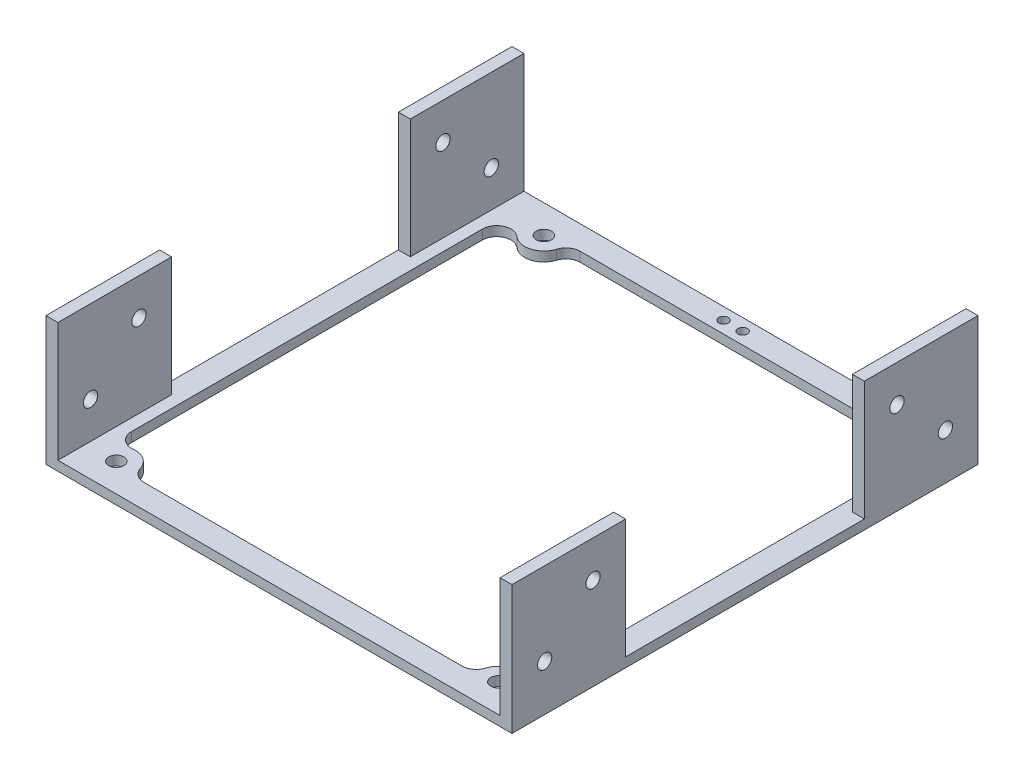
from build123d import *

# Parameters (mm, degrees)
SKETCH_1_W          = 97.6
SKETCH_1_H          = 97.6
SKETCH_1_R          = 1.59
EXTRUDE_1_DEPTH     = 2
SKETCH_2_R          = 1
CUT_EXTRUDE_1_DEPTH = 139.04173282
SKETCH_7_W          = 2.5
SKETCH_7_H          = 23.8
EXTRUDE_2_DEPTH     = 25
SKETCH_8_R          = 1.5
CUT_EXTRUDE_2_DEPTH = 141.643236595


with BuildPart() as part:
    # Эскиз1 → Бобышка-Вытянуть1 (new body)
    with BuildSketch(Plane(origin=(0, 0, 0), x_dir=(1, 0, 0), z_dir=(0, 1, 0))):
        with Locations((48.8, 48.8)):
            Rectangle(SKETCH_1_W, SKETCH_1_H)
        with Locations(Location((86.265001451, 91.665000306, 0), (0, 0, 270))):
            Circle(SKETCH_1_R, mode=Mode.SUBTRACT)
        with Locations(Location((88.805001451, 5.935000306, 0), (0, 0, 270))):
            Circle(SKETCH_1_R, mode=Mode.SUBTRACT)
        with Locations(Location((8.795001451, 5.935000306, 0), (0, 0, 270))):
            Circle(SKETCH_1_R, mode=Mode.SUBTRACT)
        with Locations(Location((12.605001451, 91.665000306, 0), (0, 0, 270))):
            Circle(SKETCH_1_R, mode=Mode.SUBTRACT)
        with BuildLine():
            Line((79.576520776, 92.6), (19.293482126, 92.6))
            ThreePointArc((19.293482126, 92.6), (17.512330868, 92.014021582), (16.426990408, 90.485000131))
            ThreePointArc((16.426990408, 90.485000131), (13.697675352, 87.817135476), (9.97357205, 88.652430089))
            ThreePointArc((9.97357205, 88.652430089), (6.759176917, 89.124368033), (5, 86.393002427))
            Line((5, 86.393002427), (5, 12.889708976))
            ThreePointArc((5, 12.889708976), (6.002770009, 10.651166513), (8.340714907, 9.909119546))
            ThreePointArc((8.340714907, 9.909119546), (10.982952752, 9.28356255), (12.616990516, 7.115000131))
            ThreePointArc((12.616990516, 7.115000131), (13.702330946, 5.5859785), (15.483482314, 5))
            Line((15.483482314, 5), (82.116520587, 5))
            ThreePointArc((82.116520587, 5), (83.897671955, 5.5859785), (84.983012386, 7.115000131))
            ThreePointArc((84.983012386, 7.115000131), (86.617049451, 9.283562094), (89.259286336, 9.909119736))
            ThreePointArc((89.259286336, 9.909119736), (91.597230458, 10.651167261), (92.6, 12.889709308))
            Line((92.6, 12.889709308), (92.6, 85.510507258))
            ThreePointArc((92.6, 85.510507258), (91.13495028, 88.088089), (88.170714907, 88.148147136))
            ThreePointArc((88.170714907, 88.148147136), (84.753959284, 87.961386993), (82.443012494, 90.485000131))
            ThreePointArc((82.443012494, 90.485000131), (81.357672034, 92.014021582), (79.576520776, 92.6))
        make_face(mode=Mode.SUBTRACT)
    extrude(amount=EXTRUDE_1_DEPTH)

    # Эскиз2 → Вырез-Вытянуть1 (cut, through all)
    with BuildSketch(Plane(origin=(0, 2, 0), x_dir=(1, 0, 0), z_dir=(0, 1, 0))):
        with Locations(Location((46.8, 95.1, 0), (0, 0, 270))):
            Circle(SKETCH_2_R)
        with Locations(Location((50.8, 95.1, 0), (0, 0, 90))):
            Circle(SKETCH_2_R)
    extrude(amount=-CUT_EXTRUDE_1_DEPTH, mode=Mode.SUBTRACT)

    # Эскиз7 → Бобышка-Вытянуть2 (add)
    with BuildSketch(Plane(origin=(0, 2, 0), x_dir=(1, 0, 0), z_dir=(0, 1, 0))):
        with Locations((1.25, 11.9)):
            Rectangle(SKETCH_7_W, SKETCH_7_H)
        with Locations((1.25, 85.7)):
            Rectangle(SKETCH_7_W, SKETCH_7_H)
        with Locations((96.35, 85.7)):
            Rectangle(SKETCH_7_W, SKETCH_7_H)
        with Locations((96.35, 11.9)):
            Rectangle(SKETCH_7_W, SKETCH_7_H)
    extrude(amount=EXTRUDE_2_DEPTH)

    # Эскиз8 → Вырез-Вытянуть2 (cut, through all)
    with BuildSketch(Plane.ZY):
        with Locations((-80.630070031, 19.32657333)):
            Circle(SKETCH_8_R)
        with Locations(Location((-90.769929969, 9.67342667, 0), (0, 0, 180))):
            Circle(SKETCH_8_R)
        with Locations((-6.830070031, 9.67342667)):
            Circle(SKETCH_8_R)
        with Locations(Location((-16.969929969, 19.32657333, 0), (0, 0, 180))):
            Circle(SKETCH_8_R)
    extrude(amount=-CUT_EXTRUDE_2_DEPTH, mode=Mode.SUBTRACT)


solid = part.part
